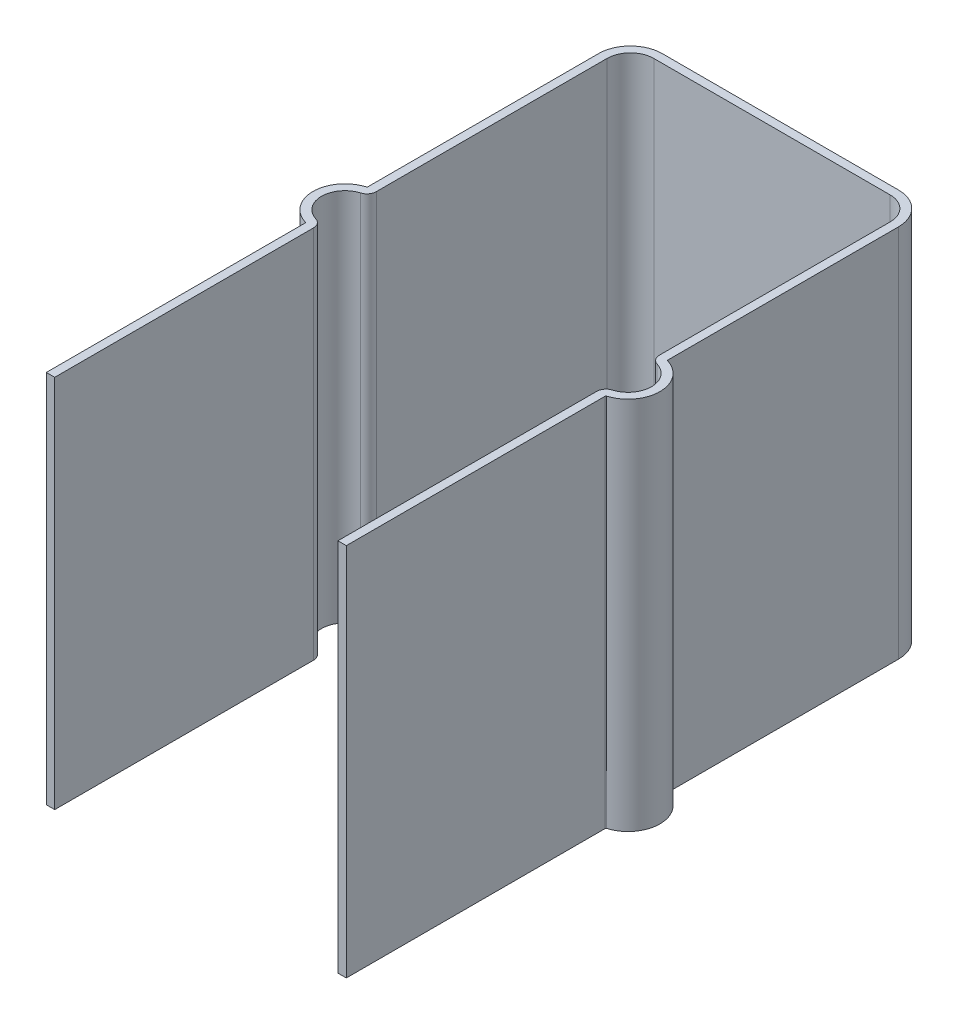
from build123d import *

# Parameters (mm, degrees)
EXTRUDE_THIN1_DEPTH = 8


with BuildPart() as part:
    # Sketch1 → Extrude-Thin1 (new body)
    with BuildSketch(Plane(origin=(0, 0, 0), x_dir=(1, 0, 0), z_dir=(0, 1, 0))):
        with BuildLine():
            Line((-3.025, -6.2), (-3.025, -0.670820393))
            ThreePointArc((-3.025, -0.670820393), (-3.064643255, -0.551297532), (-3.167857143, -0.479157424))
            ThreePointArc((-3.167857143, -0.479157424), (-3.525, 0), (-3.167857143, 0.479157424))
            ThreePointArc((-3.167857143, 0.479157424), (-3.064643255, 0.551297532), (-3.025, 0.670820393))
            Line((-3.025, 0.670820393), (-3.025, 5.6))
            ThreePointArc((-3.025, 5.6), (-2.878553391, 5.953553391), (-2.525, 6.1))
            Line((-2.525, 6.1), (2.525, 6.1))
            ThreePointArc((2.525, 6.1), (2.878553391, 5.953553391), (3.025, 5.6))
            Line((3.025, 5.6), (3.025, 0.670820393))
            ThreePointArc((3.025, 0.670820393), (3.064643255, 0.551297532), (3.167857143, 0.479157424))
            ThreePointArc((3.167857143, 0.479157424), (3.525, 0), (3.167857143, -0.479157424))
            ThreePointArc((3.167857143, -0.479157424), (3.064643255, -0.551297532), (3.025, -0.670820393))
            Line((3.025, -0.670820393), (3.025, -6.2))
            Line((3.025, -6.2), (3.205, -6.2))
            Line((3.205, -6.2), (3.205, -0.670820393))
            ThreePointArc((3.205, -0.670820393), (3.208964325, -0.658868107), (3.219285714, -0.651654096))
            ThreePointArc((3.219285714, -0.651654096), (3.705, 0), (3.219285714, 0.651654096))
            ThreePointArc((3.219285714, 0.651654096), (3.208964325, 0.658868107), (3.205, 0.670820393))
            Line((3.205, 0.670820393), (3.205, 5.6))
            ThreePointArc((3.205, 5.6), (3.005832611, 6.080832611), (2.525, 6.28))
            Line((2.525, 6.28), (-2.525, 6.28))
            ThreePointArc((-2.525, 6.28), (-3.005832611, 6.080832611), (-3.205, 5.6))
            Line((-3.205, 5.6), (-3.205, 0.670820393))
            ThreePointArc((-3.205, 0.670820393), (-3.208964325, 0.658868107), (-3.219285714, 0.651654096))
            ThreePointArc((-3.219285714, 0.651654096), (-3.705, 0), (-3.219285714, -0.651654096))
            ThreePointArc((-3.219285714, -0.651654096), (-3.208964325, -0.658868107), (-3.205, -0.670820393))
            Line((-3.205, -0.670820393), (-3.205, -6.2))
            Line((-3.205, -6.2), (-3.025, -6.2))
        make_face()
    extrude(amount=EXTRUDE_THIN1_DEPTH)


solid = part.part
